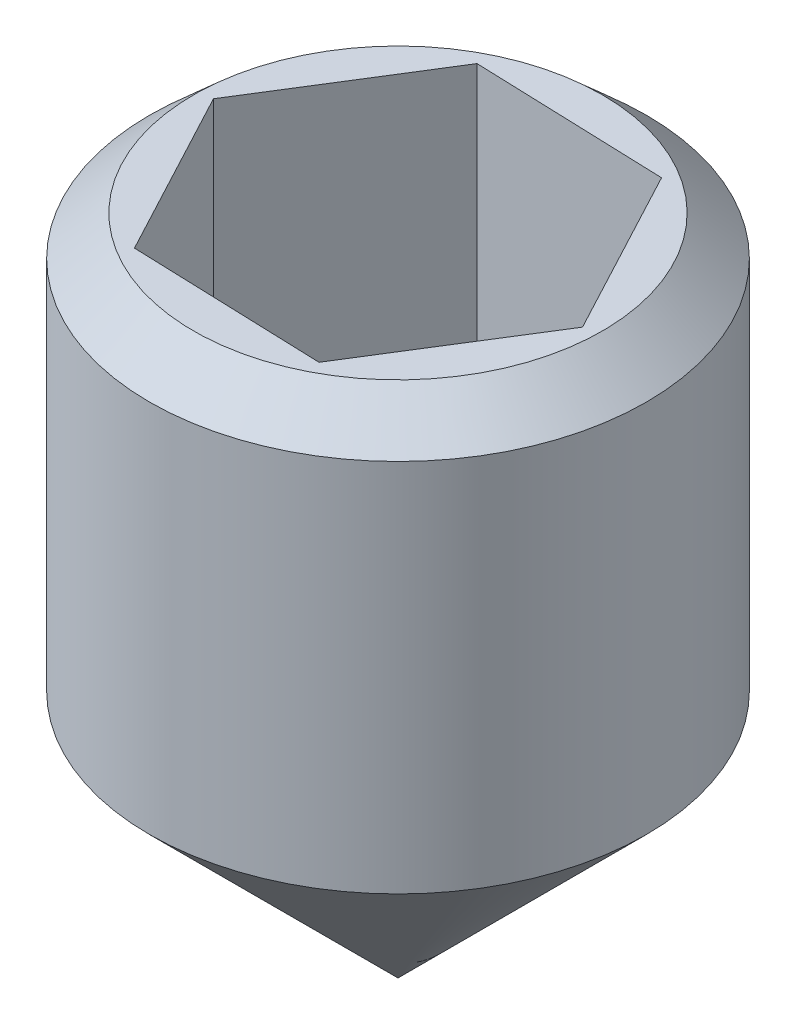
from build123d import *

# Parameters (mm, degrees)
CUT_EXTRUDE_1_DEPTH = 2


with BuildPart() as part:
    # Эскиз1 → Повернуть1 (revolve)
    with BuildSketch(Plane.XY, mode=Mode.PRIVATE) as revolve_1_sk:
        Polygon((0, 0), (0, 4), (-1.234377132, 4), (-1.5, 3.761099228), (-1.5, 1.5), align=None)
    revolve(revolve_1_sk.sketch.rotate(Axis((0, 0, 0), (0, 1, 0)), 270), axis=Axis((0, 0, 0), (0, 1, 0)))

    # Эскиз2 → Вырез-Вытянуть1 (cut)
    with BuildSketch(Plane(origin=(0, 4, 0), x_dir=(1, 0, 0), z_dir=(0, 1, 0))):
        Polygon((-0.611612581, -0.979419922), (0.542396243, -1.019381994), (1.154008824, -0.039962072), (0.611612581, 0.979419922), (-0.542396243, 1.019381994), (-1.154008824, 0.039962072), align=None)
    extrude(amount=-CUT_EXTRUDE_1_DEPTH, mode=Mode.SUBTRACT)


solid = part.part
